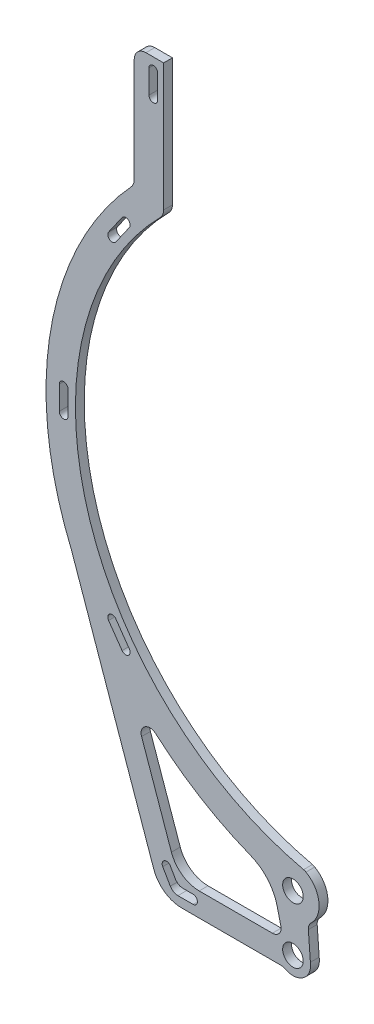
from build123d import *

# Parameters (mm, degrees)
SKETCH_1_R               = 1.5
EXTRUDE_1_DEPTH          = 3
FILLET_5_R               = 4
EXTRUDE_START            = -3
EXTRUDE_2_DEPTH          = 3
FILLET_7_R               = 3
FILLET_8_R               = 10
SKETCH_3_R               = 1.5
CUT_EXTRUDE_1_DEPTH      = 247.206358511
FILLET_9_R               = 3
CUT_EXTRUDE_2_DEPTH      = 9.5
FILLET_10_R              = 3
CUT_EXTRUDE_3_DEPTH      = 9.5
CUT_EXTRUDE_4_DEPTH      = 247.206358511
SKETCH_7_R               = 3.5
SKETCH_7_R_2             = 1.5
CUT_EXTRUDE_5_DEPTH      = 55
SKETCH_8_R               = 6
SKETCH_8_R_2             = 3.5
EXTRUDE_3_DEPTH          = 3
EXTRUDE_5_DEPTH          = 3
CUT_EXTRUDE_6_DEPTH      = 247.206358511
CUT_EXTRUDE_6_DEPTH_BACK = 247.206358511
SKETCH_12_R              = 3.5
FILLET_13_R              = 3
EXTRUDE_6_DEPTH          = 3
FILLET_14_R              = 3
FILLET_15_R              = 15


with BuildPart() as part:
    # 草图1 → 凸台-拉伸1 (new body)
    with BuildSketch(Plane.XY):
        with BuildLine():
            Line((4, -6.5), (4, 17.450012814))
            ThreePointArc((4, 17.450012814), (-70.193717354, 87.672930243), (-44, 186.414284285))
            Line((-44, 186.414284285), (-44, 231.414284285))
            Line((-44, 231.414284285), (-54, 231.414284285))
            Line((-54, 231.414284285), (-54, 190.498344353))
            ThreePointArc((-54, 190.498344353), (-80.042429579, 85.759563462), (-4, 9.169947557))
            Line((-4, 9.169947557), (-4, -6.5))
            ThreePointArc((-4, -6.5), (0, -14.5), (4, -6.5))
        make_face()
        with BuildLine():
            ThreePointArc((-1.5, -9.5), (0, -8), (1.5, -9.5))
            Line((1.5, -9.5), (-1.5, -9.5))
        make_face(mode=Mode.SUBTRACT)
        with Locations((0, 9.5)):
            Circle(SKETCH_1_R, mode=Mode.SUBTRACT)
    extrude(amount=EXTRUDE_1_DEPTH)

    # 圆角5
    fillet_5_edges = [part.edges().sort_by_distance(p)[0] for p in [
        (-54, 190.498344353, 1.5),
        (-54, 231.414284285, 1.5),
        (-44, 186.414284285, 1.5),
    ]]
    fillet(fillet_5_edges, radius=FILLET_5_R)

    # 草图2 → 凸台-拉伸2 (add)
    with BuildSketch(Plane.XY.offset(3).offset(EXTRUDE_START)):
        with BuildLine():
            Line((-45, -14.5), (0, -14.5))
            ThreePointArc((0, -14.5), (-4.472135955, -11.736067977), (-4, -6.5))
            Line((-4, -6.5), (-39, -6.5))
            Line((-39, -6.5), (-55.777803301, 41.431046717))
            ThreePointArc((-55.777803301, 41.431046717), (-66.906324005, 56.106749454), (-75.43024107, 72.433508525))
            Line((-75.43024107, 72.433508525), (-45, -14.5))
        make_face()
    extrude(amount=EXTRUDE_2_DEPTH)

    # 圆角7
    fillet_7_edges = [part.edges().sort_by_distance(p)[0] for p in [
        (-55.777803301, 41.431046717, 1.5),
    ]]
    fillet(fillet_7_edges, radius=FILLET_7_R)

    # 圆角8
    fillet_8_edges = [part.edges().sort_by_distance(p)[0] for p in [
        (-39, -6.5, 1.5),
        (-45, -14.5, 1.5),
    ]]
    fillet(fillet_8_edges, radius=FILLET_8_R)

    # 草图3 → 切除-拉伸1 (cut, through all)
    with BuildSketch(Plane.XY.offset(3)):
        with Locations((0, -9.5)):
            Circle(SKETCH_3_R)
    extrude(amount=-CUT_EXTRUDE_1_DEPTH, mode=Mode.SUBTRACT)

    # 圆角9
    fillet_9_edges = [part.edges().sort_by_distance(p)[0] for p in [
        (4, -6.5, 1.5),
        (-4, -6.5, 1.5),
    ]]
    fillet(fillet_9_edges, radius=FILLET_9_R)

    # 草图4 → 切除-拉伸2 (cut)
    with BuildSketch(Plane.XY.offset(3)):
        with BuildLine():
            Line((-34, -8.5), (-39.133974596, -8.5))
            Line((-39.133974596, -8.5), (-41.700961894, -4.053847577))
            ThreePointArc((-41.700961894, -4.053847577), (-43.75, -3.504809472), (-44.299038106, -5.553847577))
            Line((-44.299038106, -5.553847577), (-40.866025404, -11.5))
            Line((-40.866025404, -11.5), (-34, -11.5))
            ThreePointArc((-34, -11.5), (-32.5, -10), (-34, -8.5))
        make_face()
    extrude(amount=-CUT_EXTRUDE_2_DEPTH, mode=Mode.SUBTRACT)

    # 圆角10
    fillet_10_edges = [part.edges().sort_by_distance(p)[0] for p in [
        (-40.866025404, -11.5, 1.5),
        (-39.133974596, -8.5, 1.5),
    ]]
    fillet(fillet_10_edges, radius=FILLET_10_R)

    # 草图5 → 切除-拉伸3 (cut)
    with BuildSketch(Plane.XY.offset(3)):
        with BuildLine():
            Line((-58.126234927, 178.788922212), (-62.714846418, 172.235705858))
            ThreePointArc((-62.714846418, 172.235705858), (-62.346483006, 170.146613137), (-60.257390285, 170.514976549))
            Line((-60.257390285, 170.514976549), (-55.668778794, 177.068192903))
            ThreePointArc((-55.668778794, 177.068192903), (-56.037142206, 179.157285624), (-58.126234927, 178.788922212))
        make_face()
        with BuildLine():
            Line((-79.5, 119), (-79.5, 111))
            ThreePointArc((-79.5, 111), (-78, 109.5), (-76.5, 111))
            Line((-76.5, 111), (-76.5, 119))
            ThreePointArc((-76.5, 119), (-78, 120.5), (-79.5, 119))
        make_face()
        with BuildLine():
            Line((-62.714846418, 57.764294142), (-58.126234927, 51.211077788))
            ThreePointArc((-58.126234927, 51.211077788), (-56.037142206, 50.842714376), (-55.668778794, 52.931807097))
            Line((-55.668778794, 52.931807097), (-60.257390285, 59.485023451))
            ThreePointArc((-60.257390285, 59.485023451), (-62.346483006, 59.853386863), (-62.714846418, 57.764294142))
        make_face()
    extrude(amount=-CUT_EXTRUDE_3_DEPTH, mode=Mode.SUBTRACT)

    # 草图6 → 切除-拉伸4 (cut, through all)
    with BuildSketch(Plane.XY.offset(3)):
        with BuildLine():
            Line((-49, 219.414284285), (-49, 227.414284285))
            ThreePointArc((-49, 227.414284285), (-47.5, 228.914284285), (-46, 227.414284285))
            Line((-46, 227.414284285), (-46, 219.414284285))
            ThreePointArc((-46, 219.414284285), (-47.5, 217.914284285), (-49, 219.414284285))
        make_face()
    extrude(amount=-CUT_EXTRUDE_4_DEPTH, mode=Mode.SUBTRACT)

    # 草图7 → 切除-拉伸5 (cut)
    with BuildSketch(Plane(origin=(0, 0, 0), x_dir=(-1, 0, 0), z_dir=(0, 0, -1))):
        with Locations((0, -9.5)):
            Circle(SKETCH_7_R)
        with Locations((0, -9.5)):
            Circle(SKETCH_7_R_2, mode=Mode.SUBTRACT)
    extrude(amount=-CUT_EXTRUDE_5_DEPTH, mode=Mode.SUBTRACT)

    # 草图8 → 凸台-拉伸3 (add)
    with BuildSketch(Plane(origin=(0, 0, 0), x_dir=(-1, 0, 0), z_dir=(0, 0, -1))):
        with Locations((0, -9.5)):
            Circle(SKETCH_8_R)
        with Locations((0, -9.5)):
            Circle(SKETCH_8_R_2, mode=Mode.SUBTRACT)
    extrude(amount=-EXTRUDE_3_DEPTH)

    # 草图11 → 凸台-拉伸5 (add)
    with BuildSketch(Plane(origin=(0, 0, 0), x_dir=(-1, 0, 0), z_dir=(0, 0, -1))):
        Polygon((-4, 17.450012814), (-4, -5.027864045), (-6, -9.5), align=None)
        Polygon((4, -3.5), (4, 9.169947557), (7.464101615, 11.169947557), align=None)
    extrude(amount=-EXTRUDE_5_DEPTH)

    # 草图12 → 切除-拉伸6 (cut, two sides: drawn at the far end of the back side and taken through both)
    with BuildSketch(Plane(origin=(0, 0, 0), x_dir=(-1, 0, 0), z_dir=(0, 0, -1)).offset(-CUT_EXTRUDE_6_DEPTH_BACK)):
        with Locations((0, 9.5)):
            Circle(SKETCH_12_R)
    extrude(amount=CUT_EXTRUDE_6_DEPTH + CUT_EXTRUDE_6_DEPTH_BACK, mode=Mode.SUBTRACT)

    # 圆角13
    fillet_13_edges = [part.edges().sort_by_distance(p)[0] for p in [
        (-3.31662479, -14.5, 1.5),
    ]]
    fillet(fillet_13_edges, radius=FILLET_13_R)

    # 草图13 → 凸台-拉伸6 (add)
    with BuildSketch(Plane.XY.offset(3)):
        with BuildLine():
            ThreePointArc((8.899590088, 9.5), (7.576313883, 14.169279569), (4, 17.450012814))
            Line((4, 17.450012814), (5.129683944, 2.227514429))
            ThreePointArc((5.129683944, 2.227514429), (7.901100813, 5.404232712), (8.899590088, 9.5))
        make_face()
    extrude(amount=-EXTRUDE_6_DEPTH)

    # 圆角14
    fillet_14_edges = [part.edges().sort_by_distance(p)[0] for p in [
        (4, 17.450012814, 1.5),
        (5.129683944, 2.227514429, 1.5),
    ]]
    fillet(fillet_14_edges, radius=FILLET_14_R)

    # 圆角15
    fillet_15_edges = [part.edges().sort_by_distance(p)[0] for p in [
        (-7.219978098, 10.136121304, 1.5),
    ]]
    fillet(fillet_15_edges, radius=FILLET_15_R)


solid = part.part
